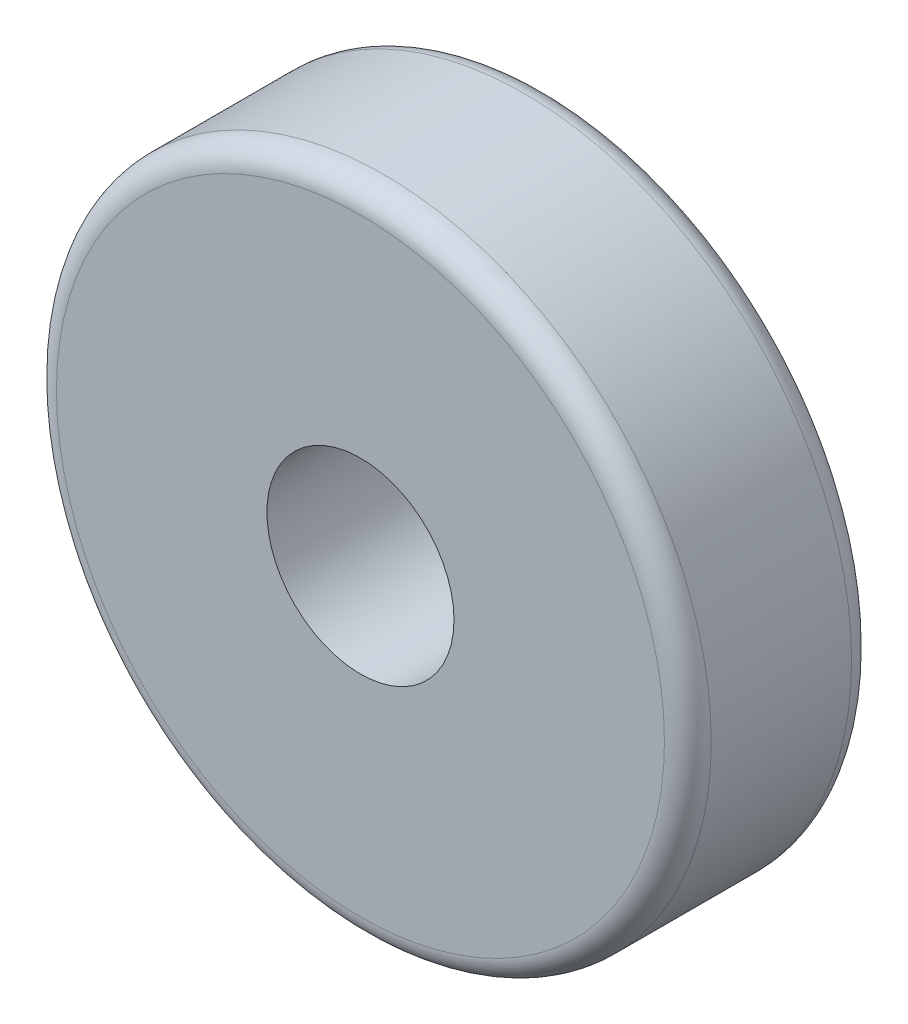
from build123d import *

# Parameters (mm, degrees)
SKETCH_1_R      = 7
SKETCH_1_R_2    = 2
EXTRUDE_1_DEPTH = 4
FILLET_1_R      = 0.5


with BuildPart() as part:
    # 草图1 → 凸台-拉伸1 (new body)
    with BuildSketch(Plane.XY):
        Circle(SKETCH_1_R)
        Circle(SKETCH_1_R_2, mode=Mode.SUBTRACT)
    extrude(amount=EXTRUDE_1_DEPTH)

    # 圆角1
    fillet_1_edges = [part.edges().sort_by_distance(p)[0] for p in [
        (-7, 0, 0),
        (-7, 0, 4),
    ]]
    fillet(fillet_1_edges, radius=FILLET_1_R)


solid = part.part
